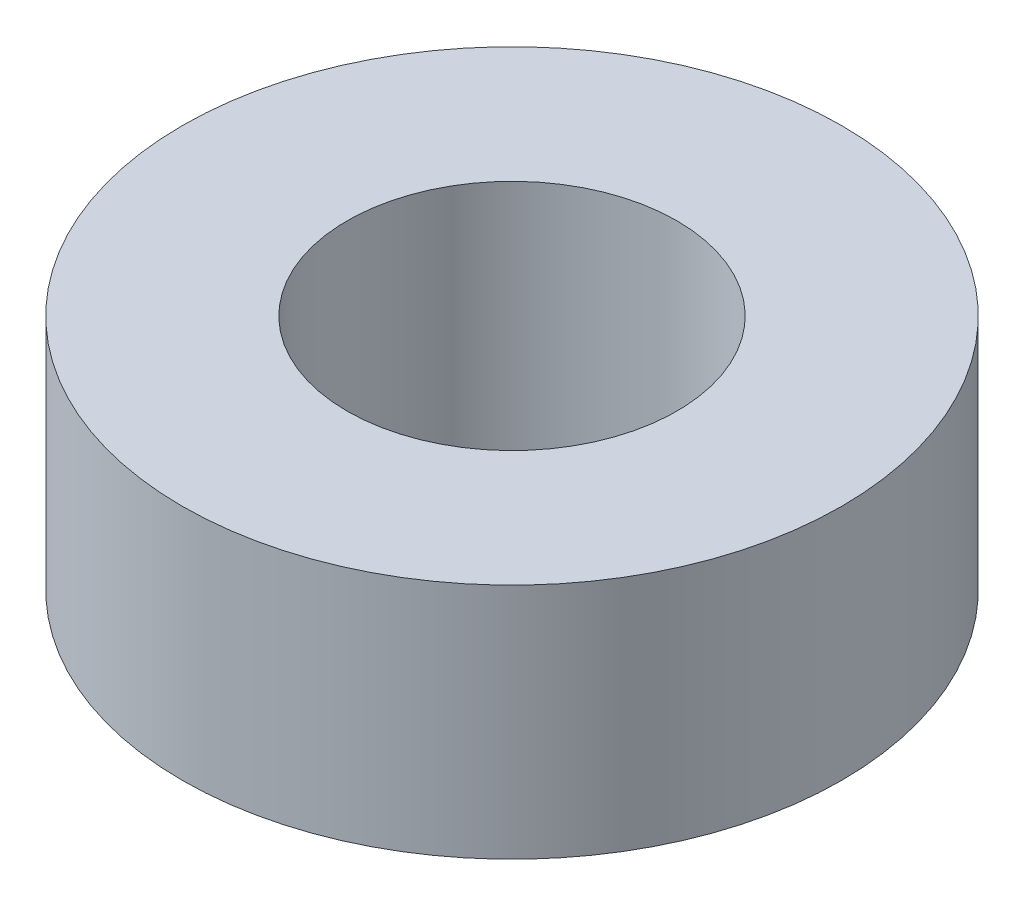
from build123d import *

# Parameters (mm, degrees)
SKETCH1_R           = 819.15
SKETCH1_R_2         = 409.702
BOSS_EXTRUDE1_DEPTH = 589.788


with BuildPart() as part:
    # Sketch1 → Boss-Extrude1 (new body)
    with BuildSketch(Plane(origin=(0, 0, 0), x_dir=(1, 0, 0), z_dir=(0, 1, 0))):
        with Locations(Location((0, 0, 0), (0, 0, 270))):
            Circle(SKETCH1_R)
        with Locations(Location((0, 0, 0), (0, 0, 270))):
            Circle(SKETCH1_R_2, mode=Mode.SUBTRACT)
    extrude(amount=BOSS_EXTRUDE1_DEPTH)


solid = part.part
